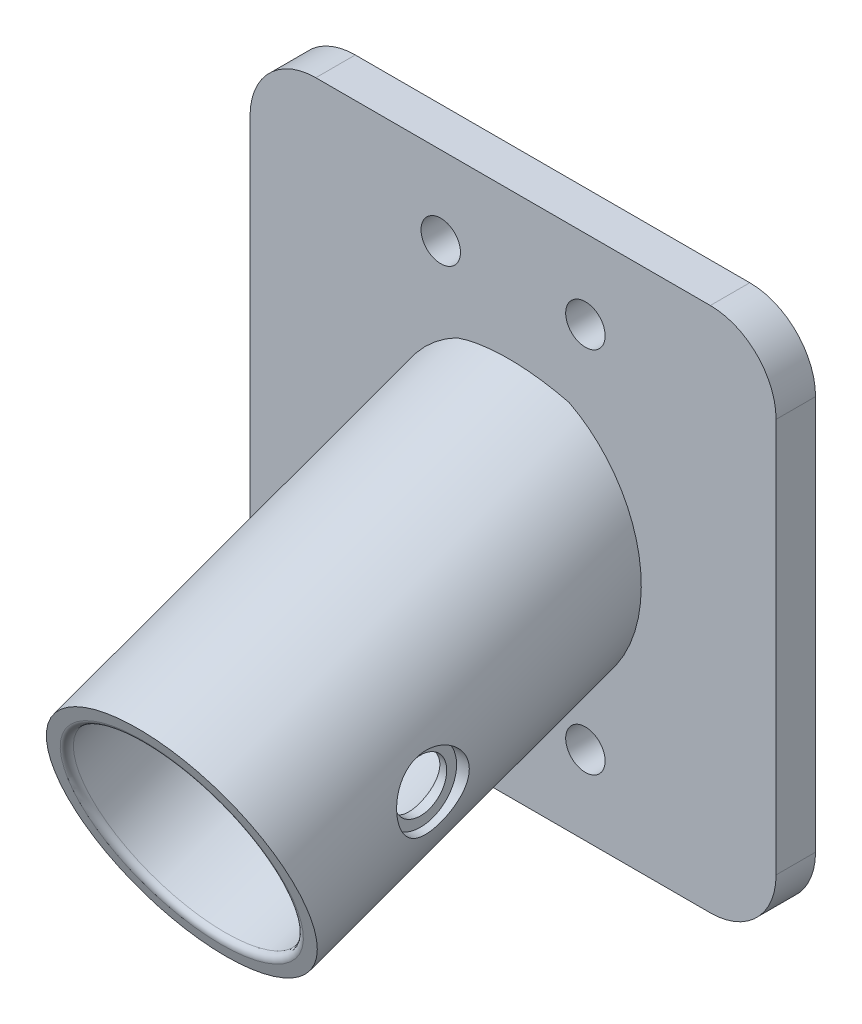
from build123d import *

# Parameters (mm, degrees)
EXTRUDE_1_DEPTH          = 3
CUT_EXTRUDE_2_DEPTH      = 29.442925307
CUT_EXTRUDE_2_DEPTH_BACK = 29.442925307
SKETCH_2_R               = 1.5
SKETCH_3_R               = 9.75
SKETCH_3_R_2             = 8.25
EXTRUDE_2_DEPTH          = 30
SKETCH_4_W               = 10.093928953
SKETCH_4_H               = 39.979180772
CUT_EXTRUDE_3_DEPTH      = 12.5
CUT_EXTRUDE_4_DEPTH      = 43.353932229
CUT_EXTRUDE_4_DEPTH_BACK = 43.353932229
SKETCH_5_R               = 2
SKETCH_6_R               = 2.75
CUT_EXTRUDE_5_DEPTH      = 1
CUT_EXTRUDE_6_DEPTH      = 1
FILLET_1_R               = 0.5


with BuildPart() as part:
    # 草圖1 → 填料-伸長1 (new body)
    with BuildSketch(Plane.XY):
        with BuildLine():
            Line((-15, 20), (15, 20))
            ThreePointArc((15, 20), (18.535533906, 18.535533906), (20, 15))
            Line((20, 15), (20, -15))
            ThreePointArc((20, -15), (18.535533906, -18.535533906), (15, -20))
            Line((15, -20), (-15, -20))
            ThreePointArc((-15, -20), (-18.535533906, -18.535533906), (-20, -15))
            Line((-20, -15), (-20, 15))
            ThreePointArc((-20, 15), (-18.535533906, 18.535533906), (-15, 20))
        make_face()
    extrude(amount=EXTRUDE_1_DEPTH)

    # 草圖2 → 除料-伸長2 (cut, two sides: drawn at the far end of the back side and taken through both)
    with BuildSketch(Plane.XY.offset(-CUT_EXTRUDE_2_DEPTH_BACK)):
        with Locations((-5.5, 14)):
            Circle(SKETCH_2_R)
        with Locations((5.5, 14)):
            Circle(SKETCH_2_R)
        with Locations((5.5, -14)):
            Circle(SKETCH_2_R)
        with Locations((-5.5, -14)):
            Circle(SKETCH_2_R)
    extrude(amount=CUT_EXTRUDE_2_DEPTH + CUT_EXTRUDE_2_DEPTH_BACK, mode=Mode.SUBTRACT)

    # 草圖3 → 填料-伸長2 (add)
    with BuildSketch(Plane(origin=(0, 0, 0), x_dir=(1, 0, 0), z_dir=(0, -0.34202014332566943, 0.9396926207859081))):
        Circle(SKETCH_3_R)
        Circle(SKETCH_3_R_2, mode=Mode.SUBTRACT)
    extrude(amount=EXTRUDE_2_DEPTH)

    # 草圖4 → 除料-伸長3 (cut, symmetric)
    with BuildSketch(Plane(origin=(0, 0, 0), x_dir=(0, 0, -1), z_dir=(1, 0, 0))):
        with Locations((5.046964477, 0.010409614)):
            Rectangle(SKETCH_4_W, SKETCH_4_H)
    extrude(amount=CUT_EXTRUDE_3_DEPTH, both=True, mode=Mode.SUBTRACT)

    # 草圖5 → 除料-伸長4 (cut, two sides: drawn at the far end of the back side and taken through both)
    with BuildSketch(Plane(origin=(0, 0, 0), x_dir=(0, 0, -1), z_dir=(1, 0, 0)).offset(-CUT_EXTRUDE_4_DEPTH_BACK)):
        with Locations((-18.793852416, -6.840402867)):
            Circle(SKETCH_5_R)
    extrude(amount=CUT_EXTRUDE_4_DEPTH + CUT_EXTRUDE_4_DEPTH_BACK, mode=Mode.SUBTRACT)

    # 草圖6 → 除料-伸長5 (cut)
    with BuildSketch(Plane(origin=(9.75, 0, 0), x_dir=(0, 0, -1), z_dir=(1, 0, 0))):
        with Locations((-18.793852416, -6.840402867)):
            Circle(SKETCH_6_R)
    extrude(amount=-CUT_EXTRUDE_5_DEPTH, mode=Mode.SUBTRACT)

    # 草圖7 → 除料-伸長6 (cut)
    with BuildSketch(Plane(origin=(-9.75, 0, 0), x_dir=(0, 0, -1), z_dir=(1, 0, 0))):
        Polygon((-15.91905864, -9.252641263), (-15.267395797, -5.556877625), (-18.142189572, -3.144639228), (-21.668646191, -4.42816447), (-22.320309035, -8.123928108), (-19.44551526, -10.536166505), align=None)
    extrude(amount=CUT_EXTRUDE_6_DEPTH, mode=Mode.SUBTRACT)

    # 圓角1
    fillet_1_edges = [part.edges().sort_by_distance(p)[0] for p in [
        (-8.25, -10.2606043, 28.190778624),
    ]]
    fillet(fillet_1_edges, radius=FILLET_1_R)


solid = part.part
